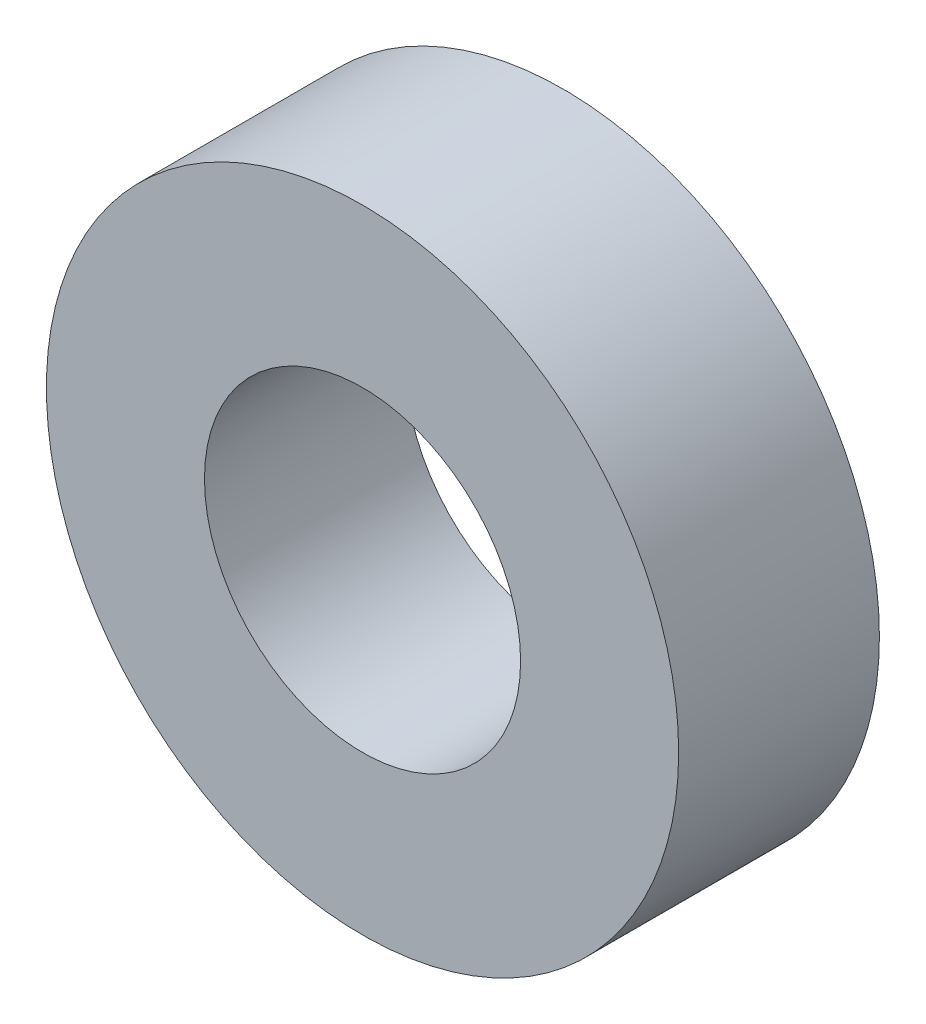
from build123d import *

# Parameters (mm, degrees)
SKETCH1_R           = 4
SKETCH1_R_2         = 2
BOSS_EXTRUDE1_DEPTH = 2.54


with BuildPart() as part:
    # Sketch1 → Boss-Extrude1 (new body)
    with BuildSketch(Plane.XY):
        Circle(SKETCH1_R)
        Circle(SKETCH1_R_2, mode=Mode.SUBTRACT)
    extrude(amount=BOSS_EXTRUDE1_DEPTH)


solid = part.part
